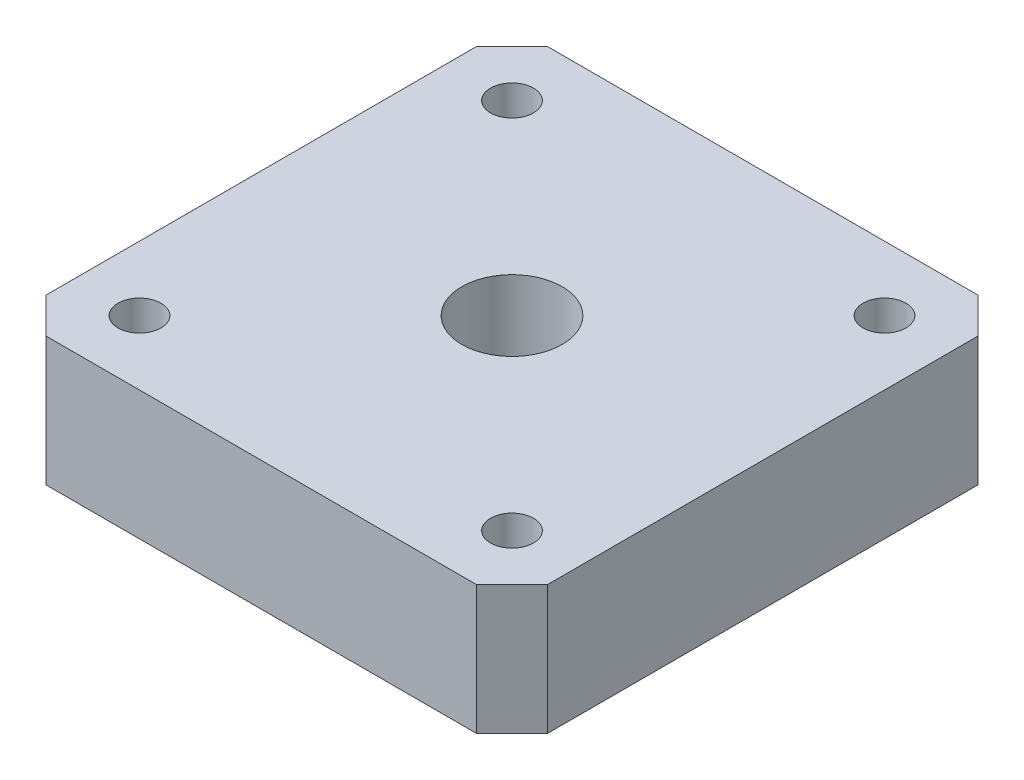
from build123d import *

# Parameters (mm, degrees)
SALIENTE_EXTRUIR1_DEPTH = 9
CROQUIS2_R              = 3.5
CORTAR_EXTRUIR1_DEPTH   = 51.309044912
CROQUIS3_R              = 1.5
CORTAR_EXTRUIR2_DEPTH   = 51.309044912


with BuildPart() as part:
    # Croquis1 → Saliente-Extruir1 (new body)
    with BuildSketch(Plane(origin=(0, 0, 0), x_dir=(1, 0, 0), z_dir=(0, 1, 0))):
        Polygon((0, 2.473088065), (2.473088065, 0), (32.526911935, 0), (35, 2.473088065), (35, 32.526911935), (32.526911935, 35), (2.473088065, 35), (0, 32.526911935), align=None)
    extrude(amount=SALIENTE_EXTRUIR1_DEPTH)

    # Croquis2 → Cortar-Extruir1 (cut, through all)
    with BuildSketch(Plane(origin=(0, 9, 0), x_dir=(1, 0, 0), z_dir=(0, 1, 0))):
        with Locations(Location((17.5, 17.5, 0), (0, 0, 270))):
            Circle(CROQUIS2_R)
    extrude(amount=-CORTAR_EXTRUIR1_DEPTH, mode=Mode.SUBTRACT)

    # Croquis3 → Cortar-Extruir2 (cut, through all)
    with BuildSketch(Plane(origin=(0, 9, 0), x_dir=(1, 0, 0), z_dir=(0, 1, 0))):
        with Locations(Location((4.5, 30.5, 0), (0, 0, 270))):
            Circle(CROQUIS3_R)
        with Locations(Location((30.5, 30.5, 0), (0, 0, 270))):
            Circle(CROQUIS3_R)
        with Locations(Location((30.5, 4.5, 0), (0, 0, 270))):
            Circle(CROQUIS3_R)
        with Locations(Location((4.5, 4.5, 0), (0, 0, 270))):
            Circle(CROQUIS3_R)
    extrude(amount=-CORTAR_EXTRUIR2_DEPTH, mode=Mode.SUBTRACT)


solid = part.part
